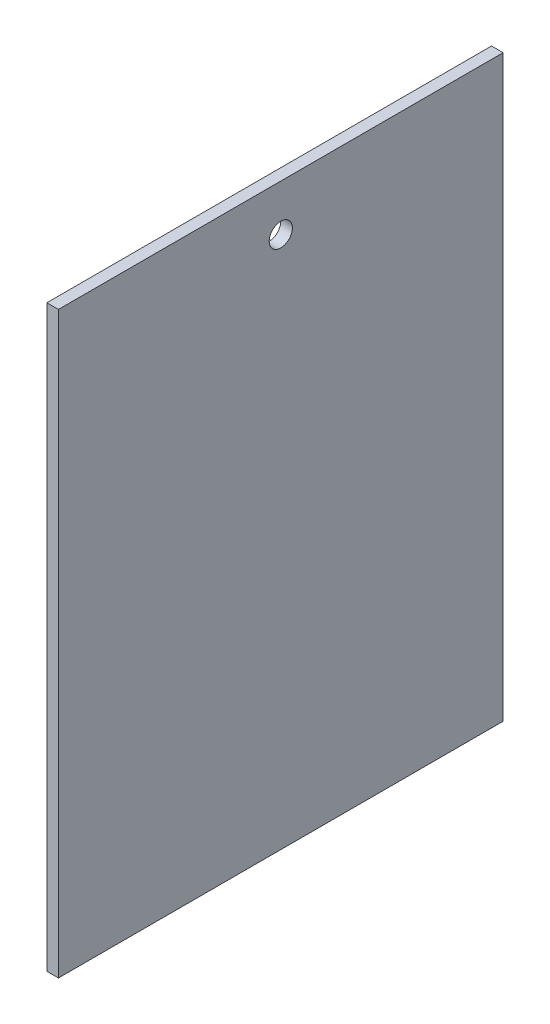
from build123d import *

# Parameters (mm, degrees)
SKETCH1_W           = 384
SKETCH1_H           = 500
BOSS_EXTRUDE1_DEPTH = 5
SKETCH2_R           = 10
CUT_EXTRUDE1_DEPTH  = 316.379136913


with BuildPart() as part:
    # Sketch1 → Boss-Extrude1 (new, symmetric)
    with BuildSketch(Plane(origin=(0, 0, 0), x_dir=(0, 0, -1), z_dir=(1, 0, 0))):
        Rectangle(SKETCH1_W, SKETCH1_H)
    extrude(amount=BOSS_EXTRUDE1_DEPTH, both=True)

    # Sketch2 → Cut-Extrude1 (cut, through all)
    with BuildSketch(Plane(origin=(5, 0, 0), x_dir=(0, 0, -1), z_dir=(1, 0, 0))):
        with Locations((0, 210)):
            Circle(SKETCH2_R)
    extrude(amount=-CUT_EXTRUDE1_DEPTH, mode=Mode.SUBTRACT)


solid = part.part
